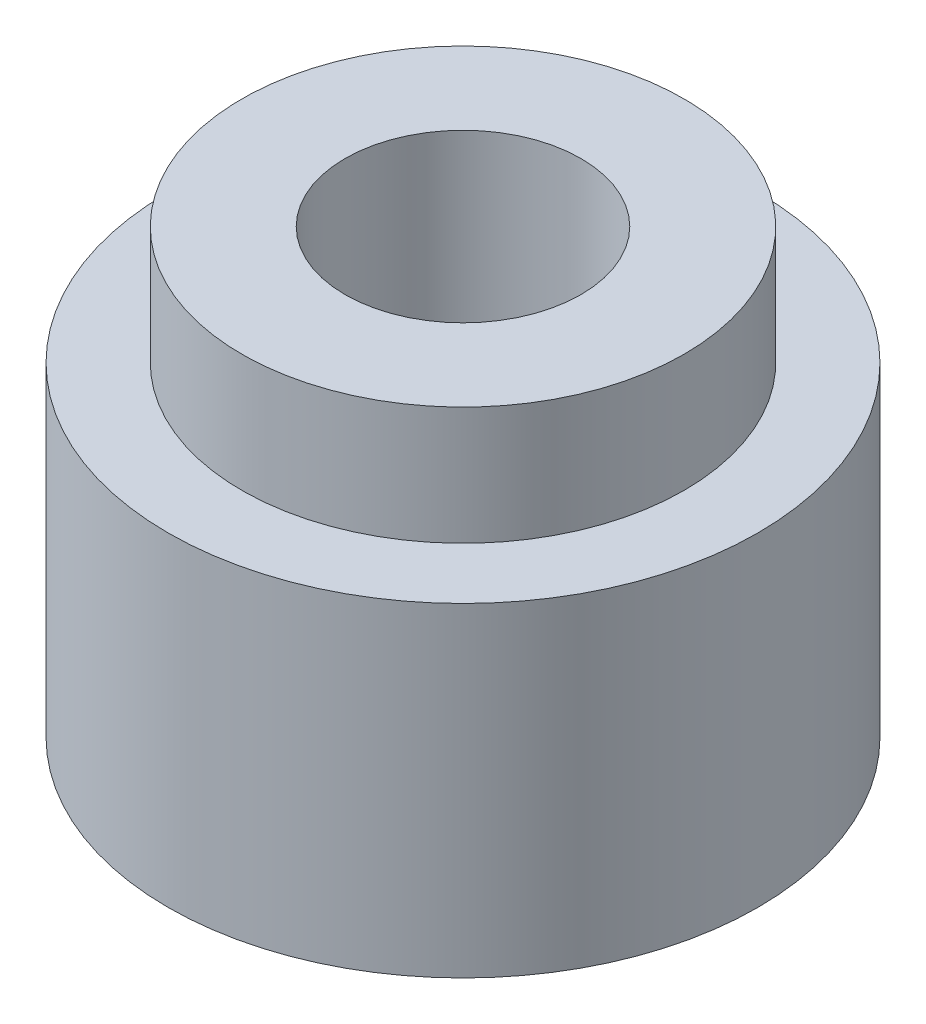
from build123d import *


with BuildPart() as part:
    # Sketch1 → Revolve1 (revolve)
    with BuildSketch(Plane.XY):
        Polygon((2.54, 0), (6.35, 0), (6.35, 6.985), (4.7625, 6.985), (4.7625, 9.525), (2.54, 9.525), align=None)
    revolve(axis=Axis((0, -1000, 0), (0, 1, 0)))


solid = part.part
